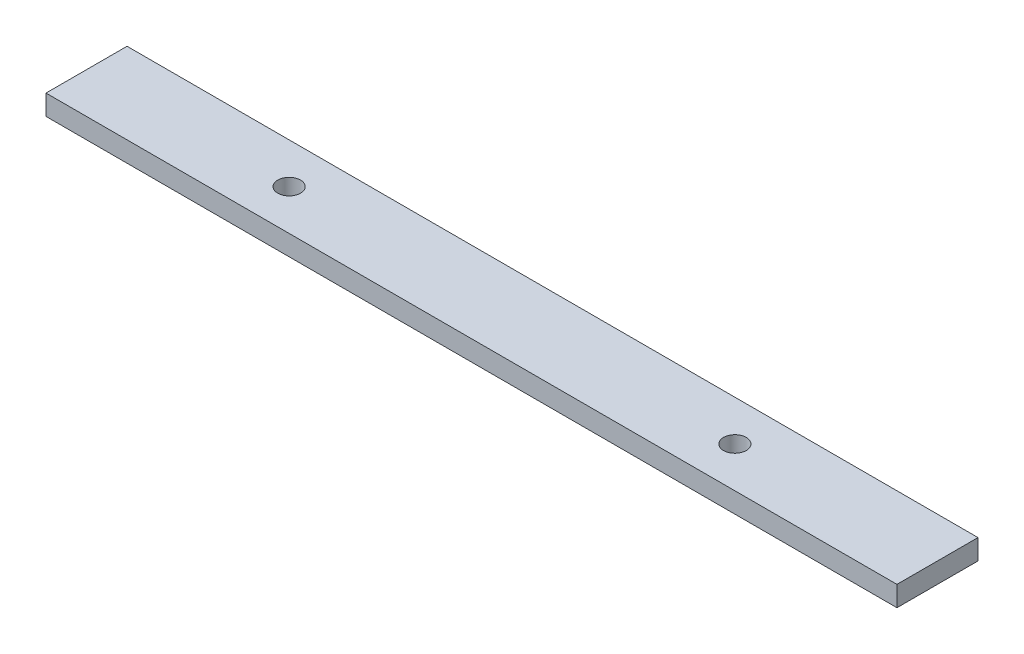
from build123d import *

# Parameters (mm, degrees)
SKETCH1_W               = 266.7
SKETCH1_H               = 25.4
BOSS_EXTRUDE1_DEPTH     = 6.35
F_1_4_CLEARANCE_HOLE2_D = 7.14248


with BuildPart() as part:
    # Sketch1 → Boss-Extrude1 (new body)
    with BuildSketch(Plane(origin=(0, 0, 0), x_dir=(1, 0, 0), z_dir=(0, 1, 0))):
        Rectangle(SKETCH1_W, SKETCH1_H)
    extrude(amount=BOSS_EXTRUDE1_DEPTH)

    # 1/4 Clearance Hole2 (through all)
    with Locations(Plane(origin=(0, 6.35, 0), x_dir=(1, 0, 0), z_dir=(0, 1, 0))):
        with Locations((-69.85, 0), (69.85, 0)):
            Hole(F_1_4_CLEARANCE_HOLE2_D / 2)


solid = part.part
